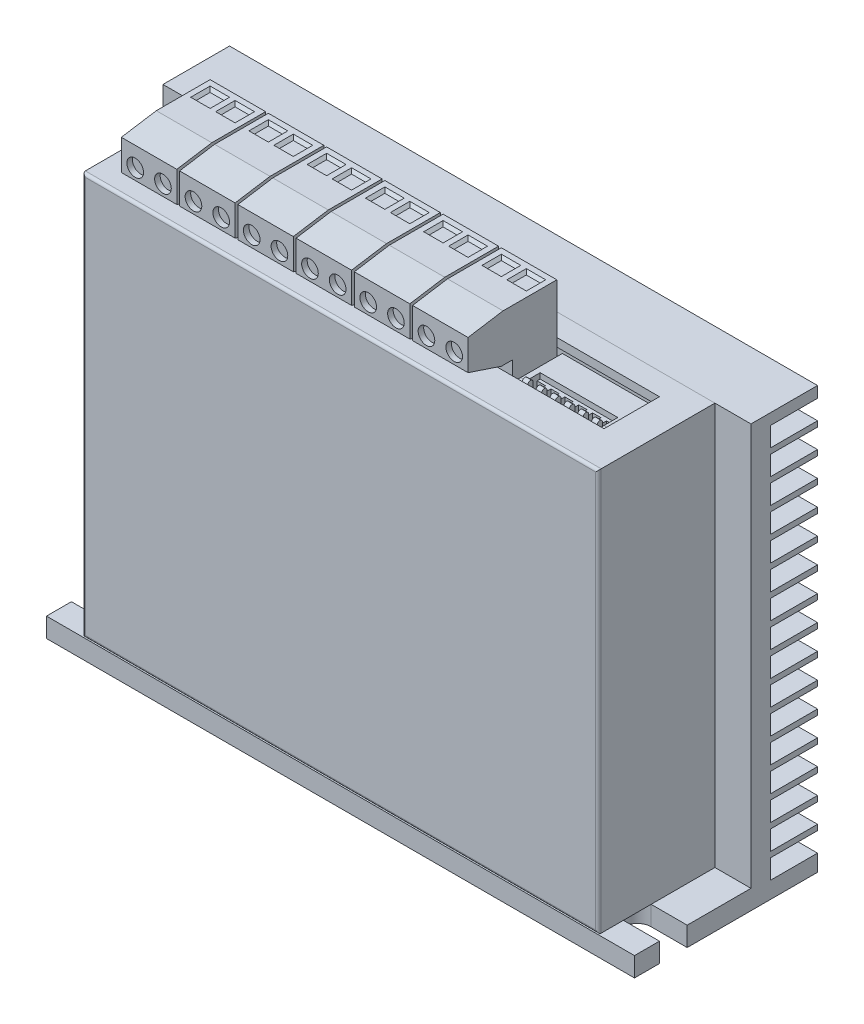
from build123d import *

# Parameters (mm, degrees)
SKETCH_1_W                     = 106
SKETCH_1_H                     = 76
EXTRUDE_1_DEPTH                = 33
SKETCH_2_W                     = 106
SKETCH_2_H                     = 72.5
CUT_EXTRUDE_1_DEPTH            = 21
SKETCH_3_W                     = 8.5
SKETCH_3_H                     = 3.5
CUT_EXTRUDE_2_DEPTH            = 135.53995689
SKETCH_5_W                     = 93
SKETCH_5_H                     = 72.5
EXTRUDE_2_DEPTH                = 21
CUT_EXTRUDE_3_DEPTH            = 3.5
SHELL_2_T                      = -1.5
SKETCH_8_W                     = 81
SKETCH_8_H                     = 10
CUT_EXTRUDE_5_DEPTH            = 1.5
FILLET_1_R                     = 0.5
SKETCH_11_W                    = 16
SKETCH_11_H                    = 9
EXTRUDE_3_DEPTH                = 10
SKETCH_12_W                    = 14
SKETCH_12_H                    = 4
CUT_EXTRUDE_7_DEPTH            = 1
SKETCH_13_W                    = 1.5
SKETCH_13_H                    = 3.44627971
CUT_EXTRUDE_8_DEPTH            = 2
FILLET_S_R                     = 1.5
CHAMFER_1_SIZE                 = 2
EXTRUDE_START                  = 0.25
EXTRUDE_4_DEPTH                = 1
PATTERN_LINEAR_1_COUNT         = 6
PATTERN_LINEAR_1_PITCH         = 2.5
EXTRUDE_START_2                = 1
EXTRUDE_5_DEPTH                = 10
SKETCH_16_W                    = 3.003957781
SKETCH_16_H                    = 11
CUT_EXTRUDE_9_DEPTH            = 1
SKETCH_17_W                    = 3.5
SKETCH_17_H                    = 3.5
CUT_EXTRUDE_11_DEPTH           = 0.5
CUT_EXTRUDE_11_DRAFT           = -45
CUT_EXTRUDE_11_PROFILE_2_DEPTH = 0.5
CUT_EXTRUDE_11_PROFILE_2_DRAFT = -45
SKETCH_18_R                    = 1.5
CUT_EXTRUDE_12_DEPTH           = 1
PATTERN_LINEAR_2_COUNT         = 6
PATTERN_LINEAR_2_PITCH         = 10.5


with BuildPart() as part:
    # Эскиз1 → Бобышка-Вытянуть1 (new body)
    with BuildSketch(Plane.XY):
        with Locations((0, 38)):
            Rectangle(SKETCH_1_W, SKETCH_1_H)
    extrude(amount=EXTRUDE_1_DEPTH)

    # Эскиз2 → Вырез-Вытянуть1 (cut)
    with BuildSketch(Plane.XY.offset(33)):
        with Locations((0, 39.75)):
            Rectangle(SKETCH_2_W, SKETCH_2_H)
    extrude(amount=-CUT_EXTRUDE_1_DEPTH, mode=Mode.SUBTRACT)

    # Эскиз3 → Вырез-Вытянуть2 (cut, through all)
    with BuildSketch(Plane(origin=(53, 0, 0), x_dir=(0, 0, -1), z_dir=(1, 0, 0))):
        with Locations((-4.25, 4.75)):
            Rectangle(SKETCH_3_W, SKETCH_3_H)
        with Locations((-4.25, 9.25)):
            Rectangle(SKETCH_3_W, SKETCH_3_H)
        with Locations((-4.25, 13.75)):
            Rectangle(SKETCH_3_W, SKETCH_3_H)
        with Locations((-4.25, 18.25)):
            Rectangle(SKETCH_3_W, SKETCH_3_H)
        with Locations((-4.25, 22.75)):
            Rectangle(SKETCH_3_W, SKETCH_3_H)
        with Locations((-4.25, 27.25)):
            Rectangle(SKETCH_3_W, SKETCH_3_H)
        with Locations((-4.25, 31.75)):
            Rectangle(SKETCH_3_W, SKETCH_3_H)
        with Locations((-4.25, 36.25)):
            Rectangle(SKETCH_3_W, SKETCH_3_H)
        with Locations((-4.25, 40.75)):
            Rectangle(SKETCH_3_W, SKETCH_3_H)
        with Locations((-4.25, 45.25)):
            Rectangle(SKETCH_3_W, SKETCH_3_H)
        with Locations((-4.25, 49.75)):
            Rectangle(SKETCH_3_W, SKETCH_3_H)
        with Locations((-4.25, 54.25)):
            Rectangle(SKETCH_3_W, SKETCH_3_H)
        with Locations((-4.25, 58.75)):
            Rectangle(SKETCH_3_W, SKETCH_3_H)
        with Locations((-4.25, 63.25)):
            Rectangle(SKETCH_3_W, SKETCH_3_H)
        with Locations((-4.25, 67.75)):
            Rectangle(SKETCH_3_W, SKETCH_3_H)
        with Locations((-4.25, 72.25)):
            Rectangle(SKETCH_3_W, SKETCH_3_H)
    extrude(amount=-CUT_EXTRUDE_2_DEPTH, mode=Mode.SUBTRACT)

    # Эскиз6 → Вырез-Вытянуть3 (cut)
    with BuildSketch(Plane.XZ):
        with BuildLine():
            Line((-53, 28.5), (-46.5, 28.5))
            ThreePointArc((-46.5, 28.5), (-44, 26), (-46.5, 23.5))
            Line((-46.5, 23.5), (-53, 23.5))
            ThreePointArc((-53, 23.5), (-55.5, 26), (-53, 28.5))
        make_face()
        with BuildLine():
            Line((53, 23.5), (46.5, 23.5))
            ThreePointArc((46.5, 23.5), (44, 26), (46.5, 28.5))
            Line((46.5, 28.5), (53, 28.5))
            ThreePointArc((53, 28.5), (55.5, 26), (53, 23.5))
        make_face()
    extrude(amount=-CUT_EXTRUDE_3_DEPTH, mode=Mode.SUBTRACT)


with BuildPart() as body_2:
    # Эскиз5 → Бобышка-Вытянуть2 (new body)
    with BuildSketch(Plane.XY.offset(12)):
        with Locations((0, 39.75)):
            Rectangle(SKETCH_5_W, SKETCH_5_H)
    extrude(amount=EXTRUDE_2_DEPTH)

    # Оболочка2
    shell_2_openings = [body_2.faces().sort_by_distance(p)[0] for p in [
        (0, 39.75, 12),
    ]]
    offset(amount=SHELL_2_T, openings=shell_2_openings, kind=Kind.INTERSECTION)

    # Эскиз8 → Вырез-Вытянуть5 (cut)
    with BuildSketch(Plane(origin=(0, 76, 0), x_dir=(1, 0, 0), z_dir=(0, 1, 0))):
        with Locations((0, -21)):
            Rectangle(SKETCH_8_W, SKETCH_8_H)
    extrude(amount=-CUT_EXTRUDE_5_DEPTH, mode=Mode.SUBTRACT)

    # Скругление1
    fillet_1_edges = [body_2.edges().sort_by_distance(p)[0] for p in [
        (0, 76, 33),
        (46.5, 39.75, 33),
        (0, 3.5, 33),
        (-46.5, 39.75, 33),
    ]]
    fillet(fillet_1_edges, radius=FILLET_1_R)


with BuildPart() as body_3:
    # Эскиз11 → Бобышка-Вытянуть3 (new body)
    with BuildSketch(Plane.XZ.offset(-74.5)):
        with Locations((31.5, 21)):
            Rectangle(SKETCH_11_W, SKETCH_11_H)
    extrude(amount=EXTRUDE_3_DEPTH)

    # Эскиз12 → Вырез-Вытянуть7 (cut)
    with BuildSketch(Plane(origin=(0, 74.5, 0), x_dir=(1, 0, 0), z_dir=(0, 1, 0))):
        with Locations((31.5, -23.5)):
            Rectangle(SKETCH_12_W, SKETCH_12_H)
    extrude(amount=-CUT_EXTRUDE_7_DEPTH, mode=Mode.SUBTRACT)

    # Эскиз13 → Вырез-Вытянуть8 (cut)
    with BuildSketch(Plane(origin=(0, 73.5, 0), x_dir=(1, 0, 0), z_dir=(0, 1, 0))):
        with Locations((27.75, -23.776860145)):
            Rectangle(SKETCH_13_W, SKETCH_13_H)
        with Locations((25.25, -23.776860145)):
            Rectangle(SKETCH_13_W, SKETCH_13_H)
        with Locations((30.25, -23.776860145)):
            Rectangle(SKETCH_13_W, SKETCH_13_H)
        with Locations((32.75, -23.776860145)):
            Rectangle(SKETCH_13_W, SKETCH_13_H)
        with Locations((35.25, -23.776860145)):
            Rectangle(SKETCH_13_W, SKETCH_13_H)
        with Locations((37.75, -23.776860145)):
            Rectangle(SKETCH_13_W, SKETCH_13_H)
    extrude(amount=-CUT_EXTRUDE_8_DEPTH, mode=Mode.SUBTRACT)

    # s
    fillet_s_edges = [body_3.edges().sort_by_distance(p)[0] for p in [
        (24, 74.5, 25.5),
        (39, 74.5, 25.5),
    ]]
    fillet(fillet_s_edges, radius=FILLET_S_R)

    # Фаска1
    chamfer_1_edges = [body_3.edges().sort_by_distance(p)[0] for p in [
        (36.5, 73.5, 25.5),
        (34, 73.5, 25.5),
        (31.5, 73.5, 25.5),
        (29, 73.5, 25.5),
        (26.5, 73.5, 25.5),
    ]]
    chamfer(chamfer_1_edges, length=CHAMFER_1_SIZE)

    # Эскиз14 → Бобышка-Вытянуть4 (add)
    with BuildSketch(Plane(origin=(24.5, 0, 0), x_dir=(0, 0, -1), z_dir=(1, 0, 0)).offset(EXTRUDE_START)):
        with BuildLine():
            Line((-25, 70.9), (-25, 74.9))
            ThreePointArc((-25, 74.9), (-24.5, 75.4), (-24, 74.9))
            Line((-24, 74.9), (-24, 70.9))
            ThreePointArc((-24, 70.9), (-24.5, 70.4), (-25, 70.9))
        make_face()
    extrude_4 = extrude(amount=EXTRUDE_4_DEPTH)

    # Линейный массив1: Бобышка-Вытянуть4 ×6
    with Locations(*[(i * PATTERN_LINEAR_1_PITCH, 0, 0) for i in range(1, PATTERN_LINEAR_1_COUNT)]):
        add(extrude_4)


with BuildPart() as body_4:
    # Эскиз15 → Бобышка-Вытянуть5 (new body)
    with BuildSketch(Plane(origin=(-40.5, 0, 0), x_dir=(0, 0, -1), z_dir=(1, 0, 0)).offset(EXTRUDE_START_2)):
        Polygon((-25, 74), (-25, 77.5), (-27, 77.5), (-33, 79.5), (-33, 85), (-26.698312594, 86), (-17, 86), (-17, 74), align=None)
    extrude(amount=EXTRUDE_5_DEPTH)

    # Эскиз16 → Вырез-Вытянуть9 (cut)
    with BuildSketch(Plane(origin=(0, 0, 17), x_dir=(-1, 0, 0), z_dir=(0, 0, -1))):
        with Locations((31.99802111, 79.5)):
            Rectangle(SKETCH_16_W, SKETCH_16_H)
        with Locations((37.00197889, 79.5)):
            Rectangle(SKETCH_16_W, SKETCH_16_H)
    extrude(amount=-CUT_EXTRUDE_9_DEPTH, mode=Mode.SUBTRACT)


with BuildPart() as cut_extrude_11_tool:
    # Эскиз17 → Вырез-Вытянуть11 (with draft: the straight prism first)
    with BuildSketch(Plane(origin=(0, 86, 0), x_dir=(1, 0, 0), z_dir=(0, 1, 0))):
        with Locations((-36.75, -19.75)):
            Rectangle(SKETCH_17_W, SKETCH_17_H)
    extrude(amount=-CUT_EXTRUDE_11_DEPTH)
    # Вырез-Вытянуть11: the draft: its side faces are tilted about the plane it starts from
    cut_extrude_11_sides = [cut_extrude_11_tool.faces().sort_by_distance(p)[0] for p in [
        (-38.5, 85.75, 19.75),
        (-36.75, 85.75, 21.5),
        (-35, 85.75, 19.75),
        (-36.75, 85.75, 18),
    ]]
    draft(cut_extrude_11_sides, Plane(origin=(0, 86, 0), x_dir=(1, 0, 0), z_dir=(0, 1, 0)), CUT_EXTRUDE_11_DRAFT)


with BuildPart() as body_4_1:
    add(body_4.part)

    # Вырез-Вытянуть11: cut by cut_extrude_11_tool
    add(cut_extrude_11_tool.part, mode=Mode.SUBTRACT)


with BuildPart() as cut_extrude_11_profile_2_tool:
    # Эскиз17 → Вырез-Вытянуть11 profile 2 (with draft: the straight prism first)
    with BuildSketch(Plane(origin=(0, 86, 0), x_dir=(1, 0, 0), z_dir=(0, 1, 0))):
        with Locations((-32.25, -19.75)):
            Rectangle(SKETCH_17_W, SKETCH_17_H)
    extrude(amount=-CUT_EXTRUDE_11_PROFILE_2_DEPTH)
    # Вырез-Вытянуть11 profile 2: the draft: its side faces are tilted about the plane it starts from
    cut_extrude_11_profile_2_sides = [cut_extrude_11_profile_2_tool.faces().sort_by_distance(p)[0] for p in [
        (-34, 85.75, 19.75),
        (-32.25, 85.75, 21.5),
        (-30.5, 85.75, 19.75),
        (-32.25, 85.75, 18),
    ]]
    draft(cut_extrude_11_profile_2_sides, Plane(origin=(0, 86, 0), x_dir=(1, 0, 0), z_dir=(0, 1, 0)), CUT_EXTRUDE_11_PROFILE_2_DRAFT)


with BuildPart() as body_4_2:
    add(body_4_1.part)

    # Вырез-Вытянуть11 profile 2: cut by cut_extrude_11_profile_2_tool
    add(cut_extrude_11_profile_2_tool.part, mode=Mode.SUBTRACT)

    # Эскиз18 → Вырез-Вытянуть12 (cut)
    with BuildSketch(Plane.XY.offset(33)):
        with Locations((-37, 81.5)):
            Circle(SKETCH_18_R)
        with Locations((-32, 81.5)):
            Circle(SKETCH_18_R)
    extrude(amount=-CUT_EXTRUDE_12_DEPTH, mode=Mode.SUBTRACT)


with BuildPart() as pattern_linear_2_1:
    # Линейный массив2: pattern copy
    add(body_4_2.part.moved(Location(Vector(1, 0, 0) * (1 * PATTERN_LINEAR_2_PITCH))))


with BuildPart() as pattern_linear_2_2:
    # Линейный массив2: pattern copy
    add(body_4_2.part.moved(Location(Vector(1, 0, 0) * (2 * PATTERN_LINEAR_2_PITCH))))


with BuildPart() as pattern_linear_2_3:
    # Линейный массив2: pattern copy
    add(body_4_2.part.moved(Location(Vector(1, 0, 0) * (3 * PATTERN_LINEAR_2_PITCH))))


with BuildPart() as pattern_linear_2_4:
    # Линейный массив2: pattern copy
    add(body_4_2.part.moved(Location(Vector(1, 0, 0) * (4 * PATTERN_LINEAR_2_PITCH))))


with BuildPart() as pattern_linear_2_5:
    # Линейный массив2: pattern copy
    add(body_4_2.part.moved(Location(Vector(1, 0, 0) * (5 * PATTERN_LINEAR_2_PITCH))))


solid = Compound([part.part, body_2.part, body_3.part, body_4_2.part, pattern_linear_2_1.part, pattern_linear_2_2.part, pattern_linear_2_3.part, pattern_linear_2_4.part, pattern_linear_2_5.part])
